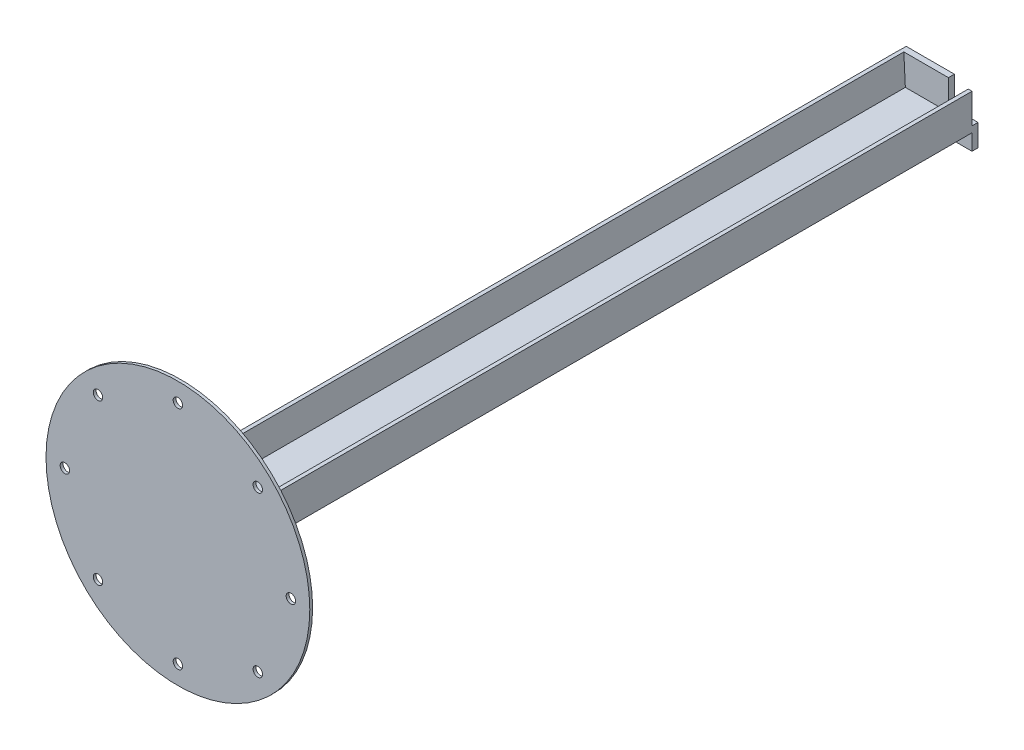
from build123d import *

# Parameters (mm, degrees)
BOSS_EXTRUDE1_DEPTH = 800
SKETCH4_W           = 50
SKETCH4_H           = 38.1
CUT_EXTRUDE2_DEPTH  = 5.6
SKETCH5_R           = 4
BOSS_EXTRUDE2_DEPTH = 30
SKETCH6_W           = 20
SKETCH6_H           = 38.1
BOSS_EXTRUDE3_DEPTH = 5
SKETCH7_W           = 76
SKETCH7_H           = 55.1
BOSS_EXTRUDE4_DEPTH = 6.35
SKETCH8_R           = 139.7
BOSS_EXTRUDE5_DEPTH = 3
SKETCH9_W           = 25
SKETCH9_H           = 31.75
CUT_EXTRUDE3_DEPTH  = 6.35
SKETCH10_R          = 2.75
CUT_EXTRUDE4_DEPTH  = 6.35
CUT_EXTRUDE5_REACH  = 837.76
SKETCH11_R          = 5
CIRPATTERN1_COUNT   = 8
BOSS_EXTRUDE6_DEPTH = 6


with BuildPart() as part:
    # Sketch1 → Boss-Extrude1 (new body)
    with BuildSketch(Plane.XY):
        Polygon((38.1, 0), (-38.1, 0), (-38.1, 38.1), (-34.1, 38.1), (-32.5, 6.35), (32.5, 6.35), (34.1, 38.1), (38.1, 38.1), align=None)
    extrude(amount=BOSS_EXTRUDE1_DEPTH)

    # Sketch4 → Cut-Extrude2 (cut)
    with BuildSketch(Plane(origin=(38.1, 0, 0), x_dir=(0, 0, -1), z_dir=(1, 0, 0))):
        with Locations((-775, 19.05)):
            Rectangle(SKETCH4_W, SKETCH4_H)
    extrude(amount=-CUT_EXTRUDE2_DEPTH, mode=Mode.SUBTRACT)

    # Sketch5 → Boss-Extrude2 (add)
    with BuildSketch(Plane(origin=(0, 6.35, 0), x_dir=(1, 0, 0), z_dir=(0, 1, 0))):
        with Locations(Location((26.1, -765, 0), (0, 0, 90))):
            Circle(SKETCH5_R)
    extrude(amount=BOSS_EXTRUDE2_DEPTH)

    # Sketch6 → Boss-Extrude3 (add)
    with BuildSketch(Plane(origin=(32.5, 0, 0), x_dir=(0, 0, -1), z_dir=(1, 0, 0))):
        with Locations((-790, 19.05)):
            Rectangle(SKETCH6_W, SKETCH6_H)
    extrude(amount=BOSS_EXTRUDE3_DEPTH)

    # Sketch7 → Boss-Extrude4 (add)
    with BuildSketch(Plane(origin=(0, 0, 0), x_dir=(-1, 0, 0), z_dir=(0, 0, -1))):
        with Locations((-0.1, 10.55)):
            Rectangle(SKETCH7_W, SKETCH7_H)
    extrude(amount=BOSS_EXTRUDE4_DEPTH)

    # Sketch8 → Boss-Extrude5 (add)
    with BuildSketch(Plane.XY.offset(800)):
        with Locations((0, 15)):
            Circle(SKETCH8_R)
    extrude(amount=BOSS_EXTRUDE5_DEPTH)

    # Sketch9 → Cut-Extrude3 (cut)
    with BuildSketch(Plane(origin=(0, 0, -6.35), x_dir=(-1, 0, 0), z_dir=(0, 0, -1))):
        with Locations((-25.6, 22.225)):
            Rectangle(SKETCH9_W, SKETCH9_H)
    extrude(amount=-CUT_EXTRUDE3_DEPTH, mode=Mode.SUBTRACT)

    # Sketch10 → Cut-Extrude4 (cut)
    with BuildSketch(Plane(origin=(0, 0, -6.35), x_dir=(-1, 0, 0), z_dir=(0, 0, -1))):
        with Locations((-21.1, -6)):
            Circle(SKETCH10_R)
        with Locations((16.9, -6)):
            Circle(SKETCH10_R)
    extrude(amount=-CUT_EXTRUDE4_DEPTH, mode=Mode.SUBTRACT)

    # Sketch11 → Cut-Extrude5 (cut, up to next)
    with BuildSketch(Plane.XY.offset(803), mode=Mode.PRIVATE) as cut_extrude5_sk1:
        with Locations((0, 134.7)):
            Circle(SKETCH11_R)
    cut_extrude5_tool1 = extrude(cut_extrude5_sk1.sketch, amount=-CUT_EXTRUDE5_REACH, mode=Mode.PRIVATE) & part.part
    cut_extrude5 = cut_extrude5_tool1.solids().sort_by_distance((0, 134.7, 803))[0]
    add(cut_extrude5, mode=Mode.SUBTRACT)

    # CirPattern1: Cut-Extrude5 ×8 about axis
    cirpattern1_axis = Axis((0, 15, 0), (0, 0, 1))
    for i in range(1, CIRPATTERN1_COUNT):
        add(cut_extrude5.rotate(cirpattern1_axis, i * 360 / CIRPATTERN1_COUNT), mode=Mode.SUBTRACT)

    # Sketch12 → Boss-Extrude6 (add)
    with BuildSketch(Plane.ZY.offset(38.1)):
        Polygon((700, 0), (800, -100), (800, 0), align=None)
    extrude(amount=-BOSS_EXTRUDE6_DEPTH)


solid = part.part
